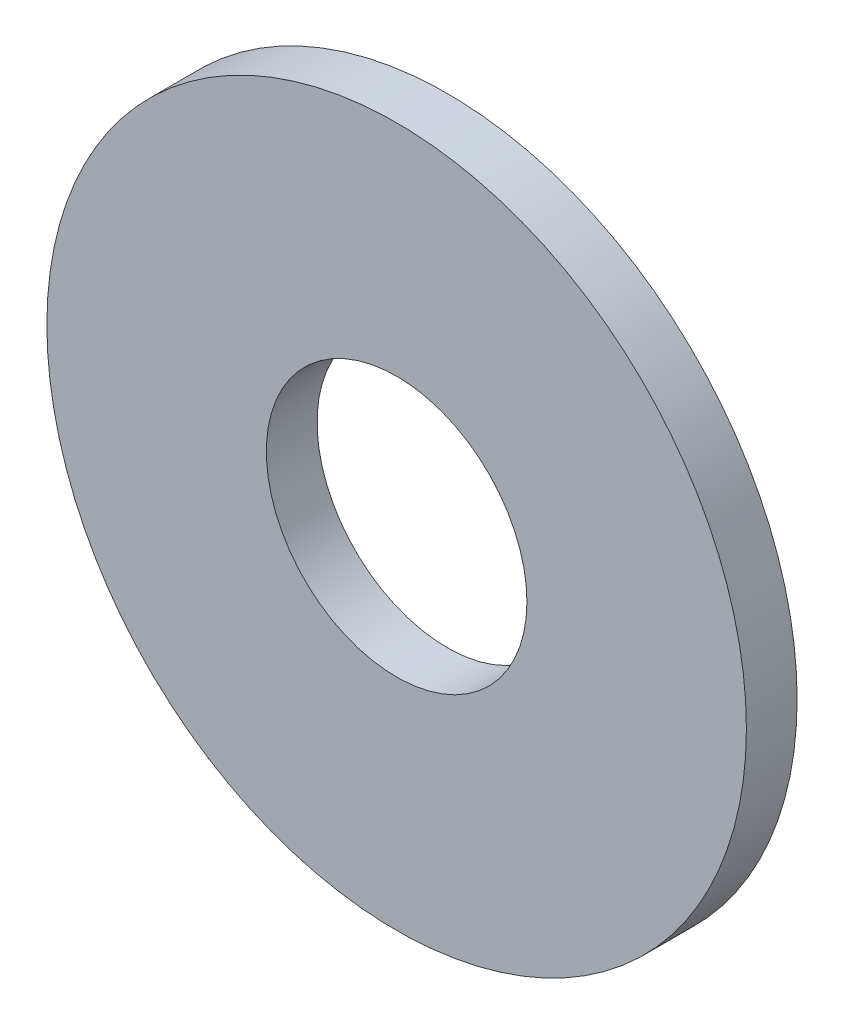
from build123d import *

# Parameters (mm, degrees)
SKETCH1_R           = 20
SKETCH1_R_2         = 7.45
BOSS_EXTRUDE1_DEPTH = 2.9


with BuildPart() as part:
    # Sketch1 → Boss-Extrude1 (new body)
    with BuildSketch(Plane.XY):
        Circle(SKETCH1_R)
        Circle(SKETCH1_R_2, mode=Mode.SUBTRACT)
    extrude(amount=BOSS_EXTRUDE1_DEPTH)


solid = part.part
